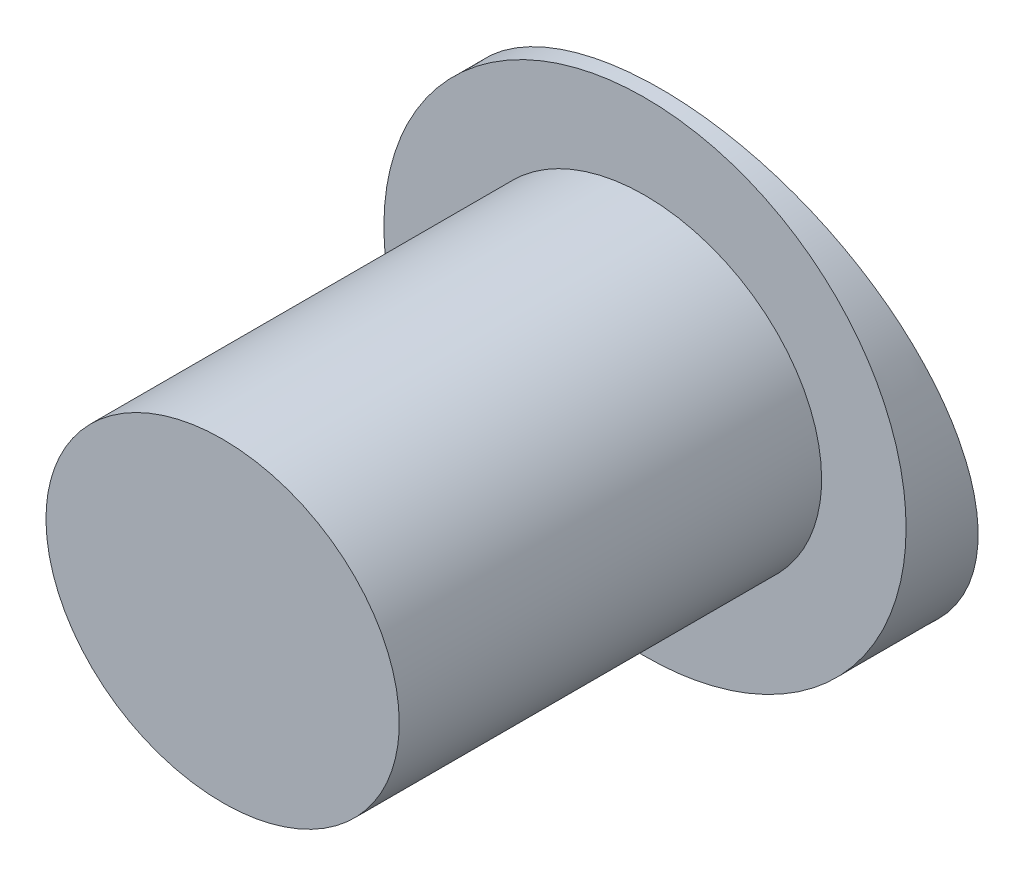
from build123d import *

# Parameters (mm, degrees)
ESQUISSE1_RX                 = 4.6
ESQUISSE1_RY                 = 4.1
BOSS_EXTRU_1_DEPTH           = 11
BOSS_EXTRU_2_DEPTH           = 3
ENL_V_MAT_EXTRU_1_DEPTH      = 17.790771458
ENL_V_MAT_EXTRU_1_DEPTH_BACK = 17.790771458


with BuildPart() as part:
    # Esquisse1 → Boss.-Extru.1 (new body)
    with BuildSketch(Plane.XY):
        with Locations((0, 0)):
            Ellipse(ESQUISSE1_RX, ESQUISSE1_RY)
    extrude(amount=-BOSS_EXTRU_1_DEPTH)

    # Esquisse2 → Boss.-Extru.2 (add)
    with BuildSketch(Plane(origin=(0, 0, -11), x_dir=(-1, 0, 0), z_dir=(0, 0, -1))):
        with BuildLine():
            add(Edge.make_bspline(
                [(6.8, 0), (6.8, 0.433288327), (6.752416239, 0.858366789), (6.5666935, 1.692899769), (6.425934966, 2.106464325), (6.065020779, 2.883515965), (5.845137822, 3.250234304), (5.457181249, 3.768157398), (5.318494152, 3.934660752), (5.027880252, 4.250125249), (4.875308752, 4.399972444), (4.556095583, 4.684394861), (4.389452723, 4.818968789), (4.042142028, 5.072893725), (3.860906146, 5.192472577), (3.306847789, 5.521794629), (2.920753337, 5.704885096), (2.116559382, 6.001289009), (1.696105458, 6.114317588), (0.853788781, 6.2628653), (0.428447413, 6.300064), (-0.215870939, 6.299967877), (-0.432632939, 6.290421243), (-0.860837611, 6.252626457), (-1.072888229, 6.224461454), (-1.702985778, 6.112619152), (-2.115035347, 6.001851771), (-2.720489724, 5.778696269), (-2.920517322, 5.694463053), (-3.307818383, 5.50998341), (-3.496159395, 5.409395212), (-4.045283112, 5.082631454), (-4.390334913, 4.831721536), (-4.873709908, 4.401578319), (-5.028199131, 4.249783181), (-5.318287954, 3.934880502), (-5.454754363, 3.771024564), (-5.710431524, 3.430429088), (-5.82964407, 3.253690889), (-6.050197932, 2.886871284), (-6.152014572, 2.69574531), (-6.425426988, 2.108484543), (-6.563239477, 1.704303519), (-6.750546991, 0.870766929), (-6.799427143, 0.436118566), (-6.800562574, -0.42060076), (-6.754602825, -0.845513068), (-6.614925469, -1.477640364), (-6.556491495, -1.686687236), (-6.418904109, -2.093093303), (-6.339500684, -2.291688747), (-6.159985006, -2.679886214), (-6.059871692, -2.869487776), (-5.838806436, -3.239641109), (-5.717766972, -3.420020335), (-5.331928585, -3.935871069), (-5.042233044, -4.250579864), (-4.560821108, -4.680506416), (-4.391806978, -4.817125956), (-4.044714464, -5.071132856), (-3.866002277, -5.189182606), (-3.314953555, -5.51748578), (-2.926157447, -5.702727312), (-2.115966571, -6.001672497), (-1.702778456, -6.112716045), (-1.071497529, -6.22467815), (-0.859140211, -6.252832392), (-0.430510974, -6.290551917), (-0.21365601, -6.300033709), (0.430786667, -6.299932309), (0.855993728, -6.26258887), (1.697634428, -6.11393502), (2.118192056, -6.000800114), (2.922433378, -5.70415255), (3.307418609, -5.521335965), (4.04218654, -5.084841779), (4.395081493, -4.827732104), (5.034128485, -4.258589957), (5.323310943, -3.945760174), (5.709346895, -3.432054044), (5.830642186, -3.25227207), (6.052893136, -2.882143426), (6.153424658, -2.692788699), (6.423703376, -2.112042029), (6.562478315, -1.708106747), (6.751855355, -0.864527395), (6.8, -0.433288327), (6.8, 0)],
                knots=[0, 0, 0, 0, 0.03125, 0.03125, 0.0625, 0.0625, 0.09375, 0.09375, 0.109375, 0.109375, 0.125, 0.125, 0.140625, 0.140625, 0.15625, 0.15625, 0.1875, 0.1875, 0.21875, 0.21875, 0.25, 0.25, 0.265625, 0.265625, 0.28125, 0.28125, 0.3125, 0.3125, 0.328125, 0.328125, 0.34375, 0.34375, 0.375, 0.375, 0.390625, 0.390625, 0.40625, 0.40625, 0.421875, 0.421875, 0.4375, 0.4375, 0.46875, 0.46875, 0.5, 0.5, 0.53125, 0.53125, 0.546875, 0.546875, 0.5625, 0.5625, 0.578125, 0.578125, 0.59375, 0.59375, 0.625, 0.625, 0.640625, 0.640625, 0.65625, 0.65625, 0.6875, 0.6875, 0.71875, 0.71875, 0.734375, 0.734375, 0.75, 0.75, 0.78125, 0.78125, 0.8125, 0.8125, 0.84375, 0.84375, 0.875, 0.875, 0.90625, 0.90625, 0.921875, 0.921875, 0.9375, 0.9375, 0.96875, 0.96875, 1, 1, 1, 1], degree=3))
        make_face()
    extrude(amount=BOSS_EXTRU_2_DEPTH)

    # Esquisse3 → Enlèv. mat.-Extru.1 (cut, two sides: drawn at the far end of the back side and taken through both)
    with BuildSketch(Plane(origin=(0, 0, 0), x_dir=(0, 0, -1), z_dir=(1, 0, 0)).offset(-ENL_V_MAT_EXTRU_1_DEPTH_BACK)):
        Polygon((14, 6.300000001), (11.406809962, 6.300000001), (14, -5.89999993), align=None)
    extrude(amount=ENL_V_MAT_EXTRU_1_DEPTH + ENL_V_MAT_EXTRU_1_DEPTH_BACK, mode=Mode.SUBTRACT)


solid = part.part
